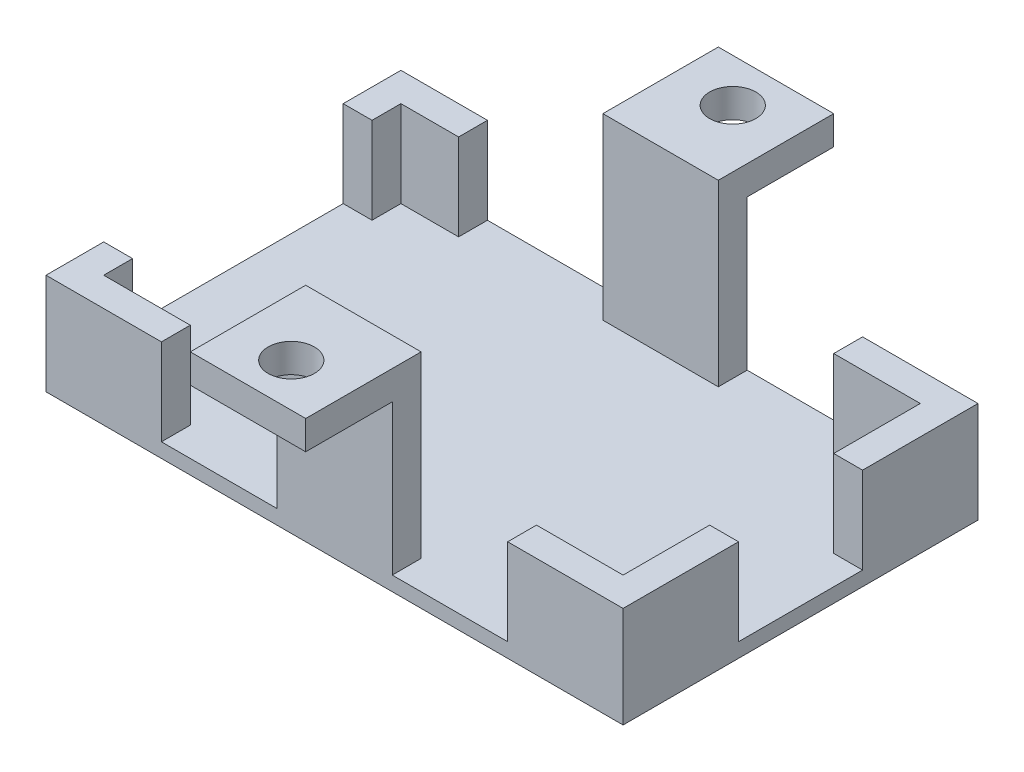
from build123d import *

# Parameters (mm, degrees)
SKETCH1_W           = 50.8
SKETCH1_H           = 31.242
BOSS_EXTRUDE1_DEPTH = 1.27
BOSS_EXTRUDE2_DEPTH = 7.62
BOSS_EXTRUDE3_DEPTH = 5.08
SKETCH4_R           = 2.032
CUT_EXTRUDE1_DEPTH  = 7.62


with BuildPart() as part:
    # Sketch1 → Boss-Extrude1 (new body)
    with BuildSketch(Plane(origin=(0, 0, 0), x_dir=(1, 0, 0), z_dir=(0, 1, 0))):
        Rectangle(SKETCH1_W, SKETCH1_H)
    extrude(amount=BOSS_EXTRUDE1_DEPTH)

    # Sketch2 → Boss-Extrude2 (add)
    with BuildSketch(Plane(origin=(0, 1.27, 0), x_dir=(1, 0, 0), z_dir=(0, 1, 0))):
        Polygon((-25.4, 10.541), (-22.86, 10.541), (-22.86, 13.081), (-17.78, 13.081), (-17.78, 15.621), (-25.4, 15.621), align=None)
        Polygon((-25.4, -10.541), (-22.86, -10.541), (-22.86, -13.081), (-15.24, -13.081), (-15.24, -15.621), (-25.4, -15.621), align=None)
        Polygon((15.24, 15.621), (25.4, 15.621), (25.4, 5.461), (22.86, 5.461), (22.86, 13.081), (15.24, 13.081), align=None)
        Polygon((25.4, -5.461), (25.4, -15.621), (15.24, -15.621), (15.24, -13.081), (22.86, -13.081), (22.86, -5.461), align=None)
    extrude(amount=BOSS_EXTRUDE2_DEPTH)

    # Sketch3 → Boss-Extrude3 (add, symmetric)
    with BuildSketch(Plane(origin=(0, 0, 0), x_dir=(0, 0, -1), z_dir=(1, 0, 0))):
        Polygon((-13.081, 0), (-15.621, 0), (-15.621, 14.478), (-23.241, 14.478), (-23.241, 17.018), (-13.081, 17.018), align=None)
    boss_extrude3 = extrude(amount=BOSS_EXTRUDE3_DEPTH, both=True)

    # Sketch4 → Cut-Extrude1 (cut)
    with BuildSketch(Plane.XZ.offset(-14.478)):
        with Locations(Location((0, 19.431, 0), (0, 0, 270))):
            Circle(SKETCH4_R)
    cut_extrude1 = extrude(amount=-CUT_EXTRUDE1_DEPTH, mode=Mode.SUBTRACT)

    # Mirror2: Boss-Extrude3 across plane
    add(boss_extrude3.mirror(Plane.XY))

    # Mirror1: Cut-Extrude1 across plane
    add(cut_extrude1.mirror(Plane.XY), mode=Mode.SUBTRACT)


solid = part.part
